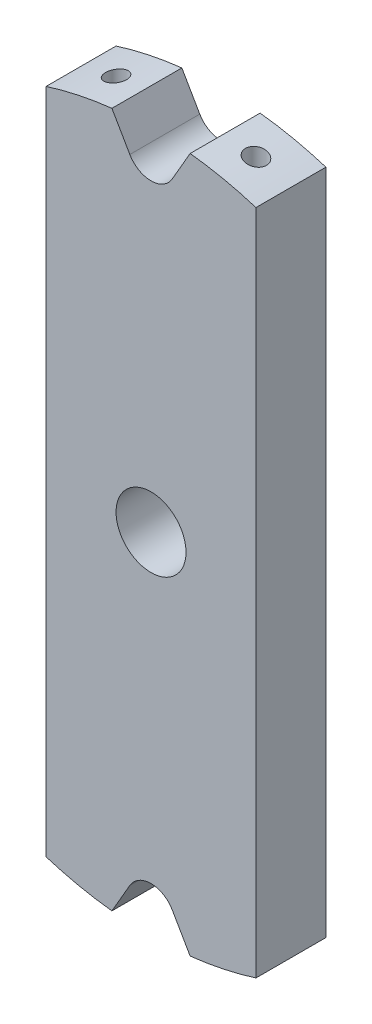
from build123d import *

# Parameters (mm, degrees)
EXTRUDE_1_DEPTH          = 10
CUT_EXTRUDE_1_DEPTH      = 53.855703508
CUT_EXTRUDE_1_DEPTH_BACK = 53.855703508
SKETCH_2_R               = 1.5
CUT_EXTRUDE_2_DEPTH      = 53.855703649
CUT_EXTRUDE_2_DEPTH_BACK = 53.855703649
SKETCH_3_R               = 5


with BuildPart() as part:
    # 草图1 → 凸台-拉伸1 (new body)
    with BuildSketch(Plane.XY):
        with BuildLine():
            ThreePointArc((-5.592370399, 49.686269666), (-10.344117547, 48.918291386), (-15, 47.696960071))
            Line((-15, 47.696960071), (-15, -47.696960071))
            ThreePointArc((-15, -47.696960071), (-10.344117547, -48.918291386), (-5.592370399, -49.686269666))
            Line((-5.592370399, -49.686269666), (-3.031088913, -45.25))
            ThreePointArc((-3.031088913, -45.25), (0, -43.5), (3.031088913, -45.25))
            Line((3.031088913, -45.25), (5.592370399, -49.686269666))
            ThreePointArc((5.592370399, -49.686269666), (10.344117547, -48.918291386), (15, -47.696960071))
            Line((15, -47.696960071), (15, 47.696960071))
            ThreePointArc((15, 47.696960071), (10.344117547, 48.918291386), (5.592370399, 49.686269666))
            Line((5.592370399, 49.686269666), (3.031088913, 45.25))
            ThreePointArc((3.031088913, 45.25), (0, 43.5), (-3.031088913, 45.25))
            Line((-3.031088913, 45.25), (-5.592370399, 49.686269666))
        make_face()
    extrude(amount=EXTRUDE_1_DEPTH)

    # 草图2 → 切除-拉伸1 (cut, two sides: drawn at the far end of the back side and taken through both)
    with BuildSketch(Plane(origin=(0, 0, 0), x_dir=(1, 0, 0), z_dir=(0, 1, 0)).offset(-CUT_EXTRUDE_1_DEPTH_BACK)):
        with Locations(Location((-10, -5, 0), (0, 0, 270))):
            Circle(SKETCH_2_R)
        with Locations(Location((10, -5, 0), (0, 0, 270))):
            Circle(SKETCH_2_R)
    extrude(amount=CUT_EXTRUDE_1_DEPTH + CUT_EXTRUDE_1_DEPTH_BACK, mode=Mode.SUBTRACT)

    # 草图3 → 切除-拉伸2 (cut, two sides: drawn at the far end of the back side and taken through both)
    with BuildSketch(Plane.XY.offset(10).offset(-CUT_EXTRUDE_2_DEPTH_BACK)):
        Circle(SKETCH_3_R)
    extrude(amount=CUT_EXTRUDE_2_DEPTH + CUT_EXTRUDE_2_DEPTH_BACK, mode=Mode.SUBTRACT)


solid = part.part
